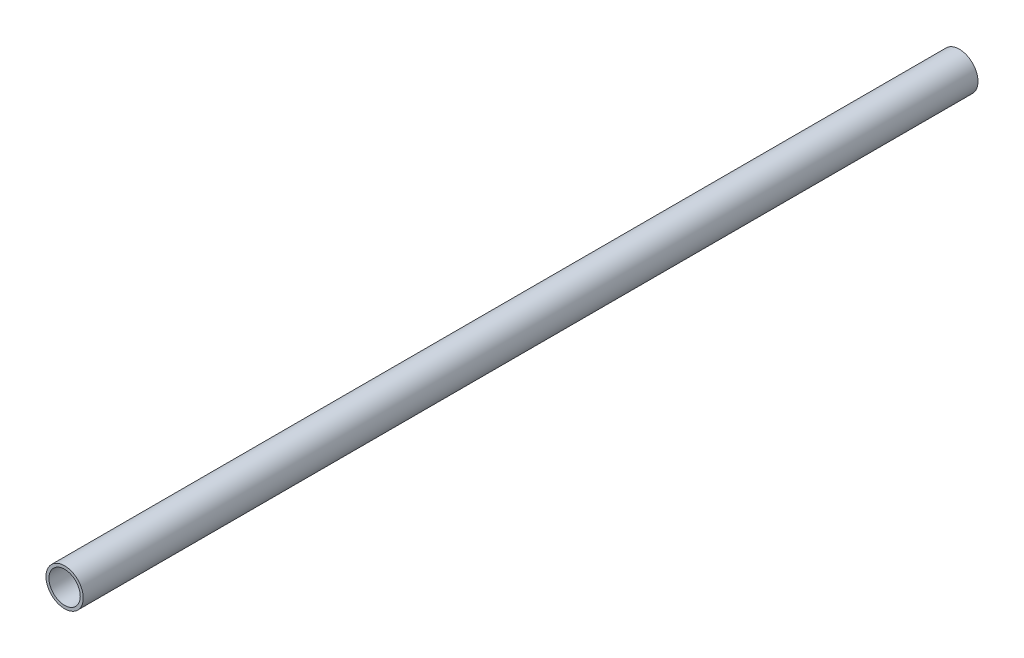
from build123d import *

# Parameters (mm, degrees)
BOSS_EXTRUDE1_DEPTH      = 457.2
BOSS_EXTRUDE1_DEPTH_BACK = 457.2
SKETCH3_R                = 19.05
SKETCH3_R_2              = 16.002


with BuildPart() as part:
    # Sketch3 → Boss-Extrude1 (new, two sides: drawn at the far end of the back side and taken through both)
    with BuildSketch(Plane.XY.offset(-BOSS_EXTRUDE1_DEPTH_BACK)):
        Circle(SKETCH3_R)
        Circle(SKETCH3_R_2, mode=Mode.SUBTRACT)
    extrude(amount=BOSS_EXTRUDE1_DEPTH + BOSS_EXTRUDE1_DEPTH_BACK)


solid = part.part
